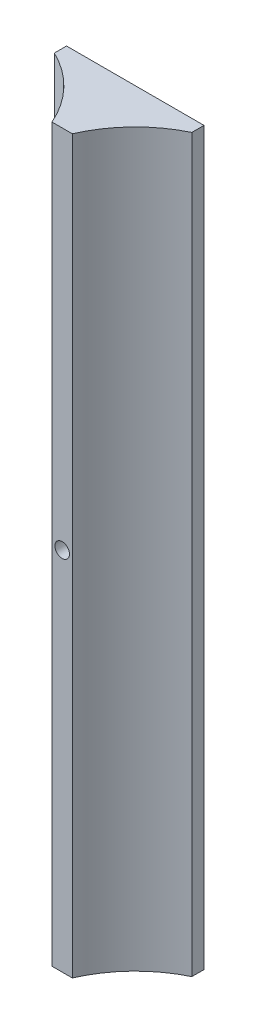
from build123d import *

# Parameters (mm, degrees)
BOSS_EXTRUDE1_DEPTH                       = 60
TAPPED_HOLE_FOR_M2_5X0_45_HELICOIL1_D     = 2.55
TAPPED_HOLE_FOR_M2_5X0_45_HELICOIL1_DEPTH = 4
TAPPED_HOLE_FOR_M2_5X0_45_HELICOIL1_TIP   = 0.766097289
F_1_2_1_2_DIAMETER_HOLE1_D                = 1.2
F_1_2_1_2_DIAMETER_HOLE1_DEPTH            = 6.45
F_1_2_1_2_DIAMETER_HOLE1_TIP              = 0.360516371


with BuildPart() as part:
    # Sketch1 → Boss-Extrude1 (new body)
    with BuildSketch(Plane(origin=(0, 0, 0), x_dir=(1, 0, 0), z_dir=(0, 1, 0))):
        with BuildLine():
            Line((-0.83484861, 0), (0.83484861, 0))
            ThreePointArc((0.83484861, 0), (2.790632181, 2.930008344), (5.641101056, 5))
            Line((5.641101056, 5), (5.641101056, 6))
            Line((5.641101056, 6), (-5.641101056, 6))
            Line((-5.641101056, 6), (-5.641101056, 5))
            ThreePointArc((-5.641101056, 5), (-2.790632181, 2.930008344), (-0.83484861, 0))
        make_face()
    extrude(amount=BOSS_EXTRUDE1_DEPTH)

    # Tapped Hole for M2.5x0.45 Helicoil1
    with Locations(Plane(origin=(0, 30, -6), x_dir=(-1, 0, 0), z_dir=(0, 0, -1))):
        with Locations((0, 0)):
            Hole(TAPPED_HOLE_FOR_M2_5X0_45_HELICOIL1_D / 2, depth=TAPPED_HOLE_FOR_M2_5X0_45_HELICOIL1_DEPTH)
            with Locations((0, 0, -(TAPPED_HOLE_FOR_M2_5X0_45_HELICOIL1_DEPTH + TAPPED_HOLE_FOR_M2_5X0_45_HELICOIL1_TIP / 2))):  # 118° drill point
                Cone(0, TAPPED_HOLE_FOR_M2_5X0_45_HELICOIL1_D / 2, TAPPED_HOLE_FOR_M2_5X0_45_HELICOIL1_TIP, mode=Mode.SUBTRACT)

    # Ø1.2 (1.2) Diameter Hole1
    with Locations(Plane(origin=(0, 30, -6), x_dir=(-1, 0, 0), z_dir=(0, 0, -1))):
        with Locations((0, 0)):
            Hole(F_1_2_1_2_DIAMETER_HOLE1_D / 2, depth=F_1_2_1_2_DIAMETER_HOLE1_DEPTH)
            with Locations((0, 0, -(F_1_2_1_2_DIAMETER_HOLE1_DEPTH + F_1_2_1_2_DIAMETER_HOLE1_TIP / 2))):  # 118° drill point
                Cone(0, F_1_2_1_2_DIAMETER_HOLE1_D / 2, F_1_2_1_2_DIAMETER_HOLE1_TIP, mode=Mode.SUBTRACT)


solid = part.part
